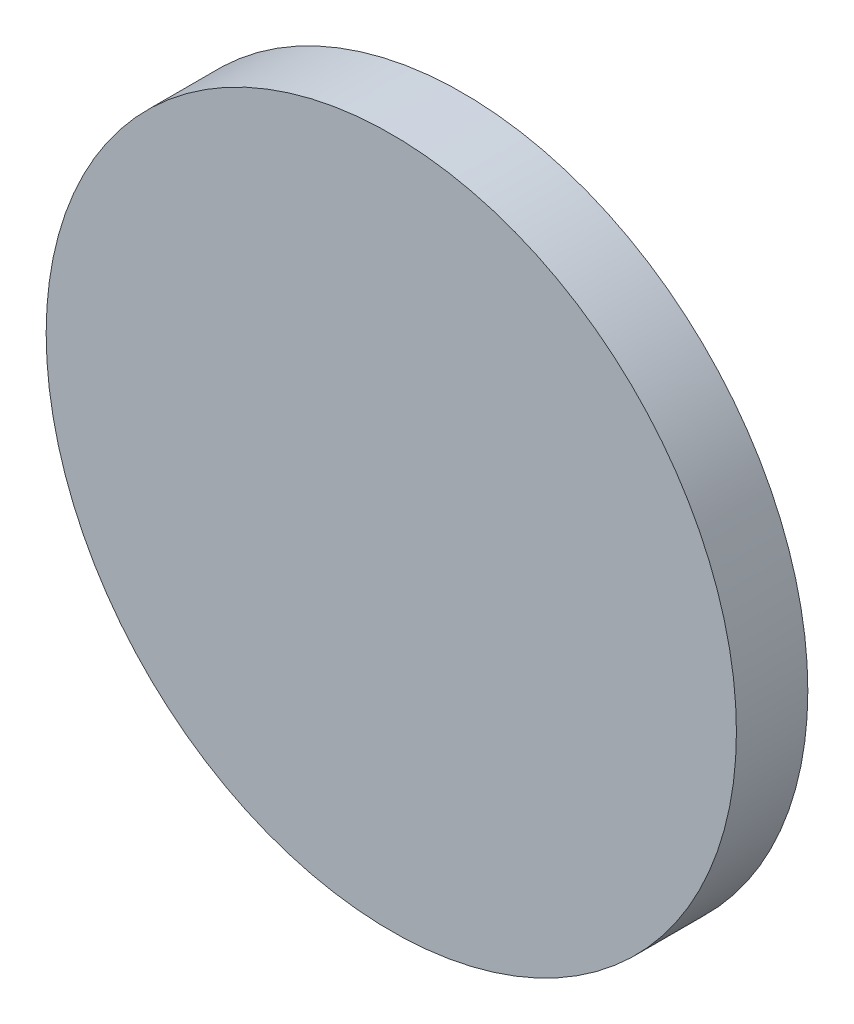
from build123d import *

# Parameters (mm, degrees)
SKETCH_1_R      = 14.5
EXTRUDE_1_DEPTH = 3


with BuildPart() as part:
    # Эскиз1 → Бобышка-Вытянуть1 (new body)
    with BuildSketch(Plane.XY):
        Circle(SKETCH_1_R)
    extrude(amount=EXTRUDE_1_DEPTH)


solid = part.part
